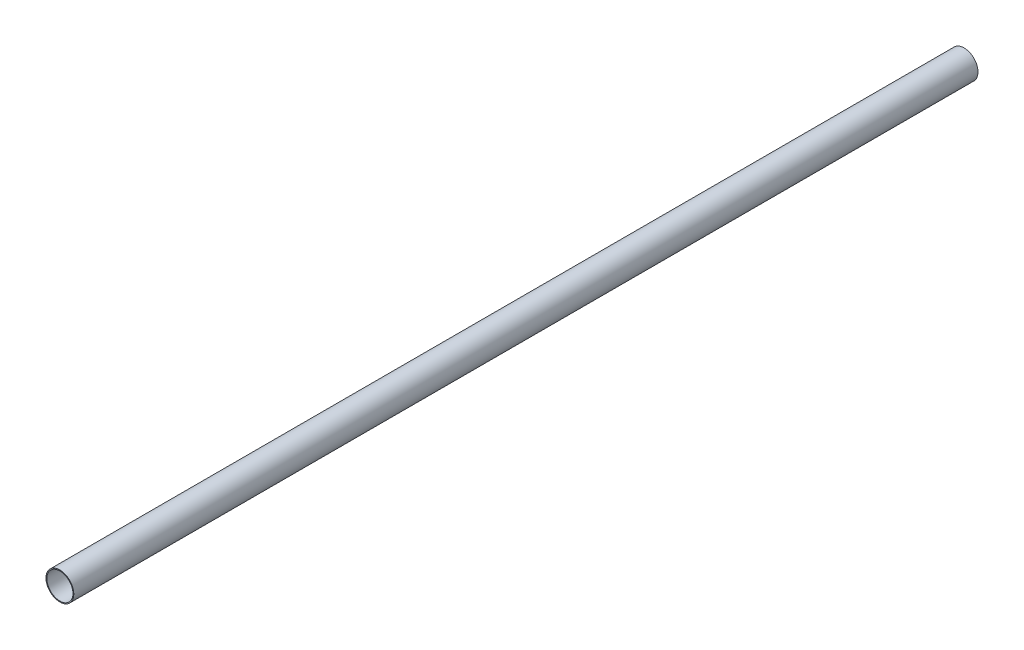
from build123d import *

# Parameters (mm, degrees)
SKETCH1_R   = 4
SKETCH1_R_2 = 3.75


with BuildPart() as part:
    # Sweep1: sweep along a path in Sketch2
    with BuildLine(Plane(origin=(0, 0, 0), x_dir=(0, 0, -1), z_dir=(1, 0, 0))) as sweep1_path:
        Line((0, 0), (260, 0))
    # Sketch1 → Sweep1 (sweep)
    with BuildSketch(Plane.XY):
        Circle(SKETCH1_R)
        Circle(SKETCH1_R_2, mode=Mode.SUBTRACT)
    sweep(path=sweep1_path.line)


solid = part.part
